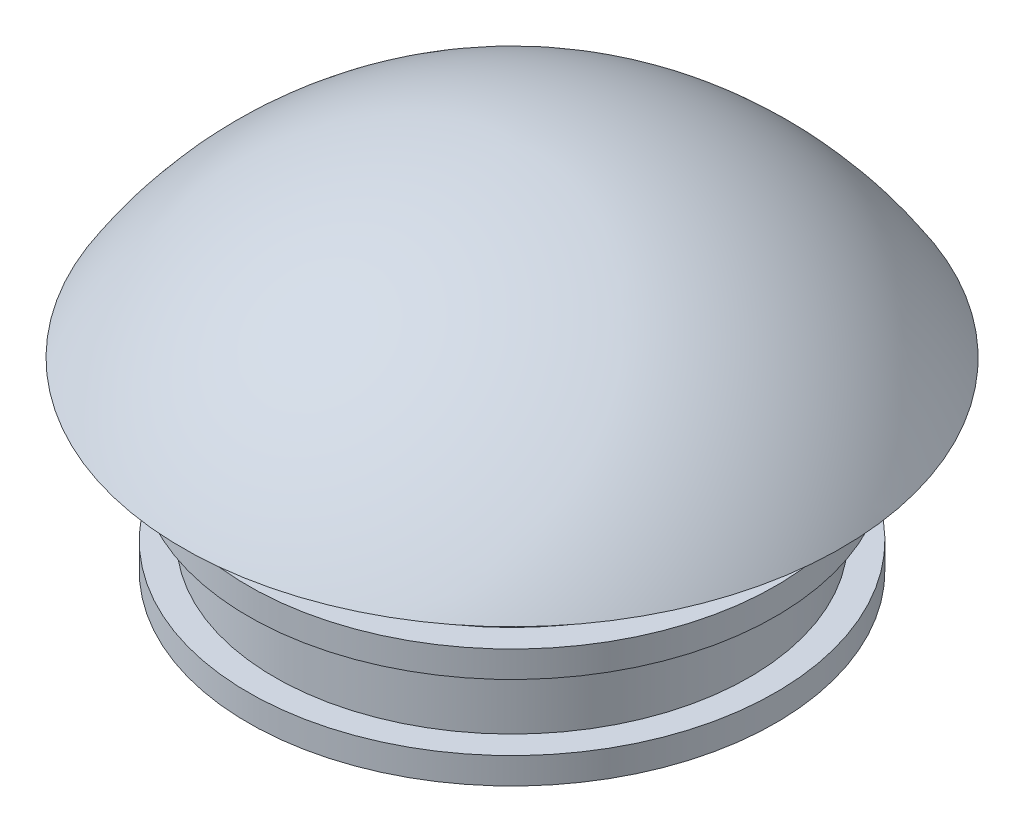
from build123d import *


with BuildPart() as part:
    # Эскиз1 → Повернуть1 (revolve)
    with BuildSketch(Plane.XY, mode=Mode.PRIVATE) as revolve_1_sk:
        with BuildLine():
            Line((-8, 4), (-8, -3))
            Line((-8, -3), (-10, -3))
            Line((-10, -3), (-10, -2))
            Line((-10, -2), (-9, -2))
            Line((-9, -2), (-9, 0.5))
            Line((-9, 0.5), (-10, 0.5))
            Line((-10, 0.5), (-10, 1.5))
            Line((-10, 1.5), (-9, 1.5))
            Line((-9, 1.5), (-9, 4))
            Line((-9, 4), (-12.5, 4))
            ThreePointArc((-12.5, 4), (-7.139719689, 9.088785159), (0, 11))
            Line((0, 11), (0, 4))
            Line((0, 4), (-8, 4))
        make_face()
    revolve(revolve_1_sk.sketch.rotate(Axis((0, 4, 0), (0, 1, 0)), 270), axis=Axis((0, 4, 0), (0, 1, 0)))


solid = part.part
